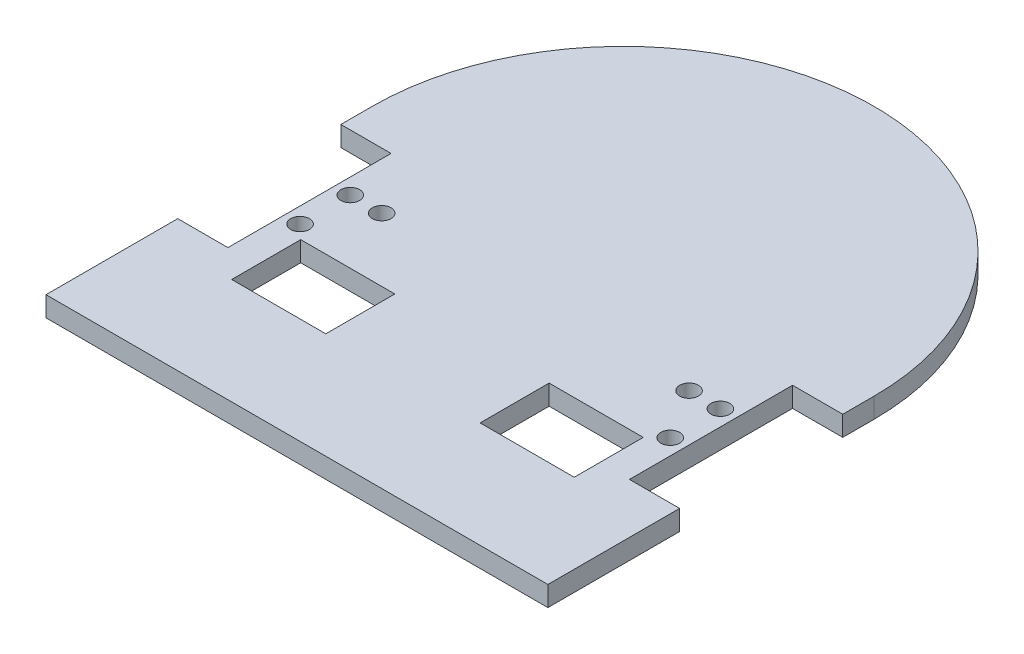
from build123d import *

# Parameters (mm, degrees)
BOSS_EXTRUDE1_DEPTH = 1.6
SKETCH2_W           = 4
SKETCH2_H           = 13
CUT_EXTRUDE2_DEPTH  = 10
SKETCH3_W           = 7.5
SKETCH3_H           = 5.5
CUT_EXTRUDE3_DEPTH  = 10
SKETCH4_R           = 0.75
CUT_EXTRUDE4_DEPTH  = 10


with BuildPart() as part:
    # Sketch1 → Boss-Extrude1 (new body)
    with BuildSketch(Plane(origin=(0, 0, 0), x_dir=(1, 0, 0), z_dir=(0, 1, 0))):
        with BuildLine():
            Line((20, 0), (20, -26))
            Line((20, -26), (-20, -26))
            Line((-20, -26), (-20, 0))
            ThreePointArc((-20, 0), (0, 20), (20, 0))
        make_face()
    extrude(amount=BOSS_EXTRUDE1_DEPTH)

    # Sketch2 → Cut-Extrude2 (cut)
    with BuildSketch(Plane(origin=(0, 3, 0), x_dir=(1, 0, 0), z_dir=(0, 1, 0))):
        with Locations((-18, -9)):
            Rectangle(SKETCH2_W, SKETCH2_H)
        with Locations((18, -9)):
            Rectangle(SKETCH2_W, SKETCH2_H)
    extrude(amount=-CUT_EXTRUDE2_DEPTH, mode=Mode.SUBTRACT)

    # Sketch3 → Cut-Extrude3 (cut)
    with BuildSketch(Plane(origin=(0, 1.6, 0), x_dir=(1, 0, 0), z_dir=(0, 1, 0))):
        with Locations((-9.9, -14.8)):
            Rectangle(SKETCH3_W, SKETCH3_H)
    cut_extrude3 = extrude(amount=-CUT_EXTRUDE3_DEPTH, mode=Mode.SUBTRACT)

    # Mirror1: Cut-Extrude3 across plane
    add(cut_extrude3.mirror(Plane(origin=(0, 0, 0), x_dir=(0, 0, 1), z_dir=(1, 0, 0))), mode=Mode.SUBTRACT)

    # Sketch4 → Cut-Extrude4 (cut)
    with BuildSketch(Plane(origin=(0, 1.6, 0), x_dir=(1, 0, 0), z_dir=(0, 1, 0))):
        with Locations(Location((-14.75, -7, 0), (0, 0, 270))):
            Circle(SKETCH4_R)
        with Locations(Location((-14.75, -11, 0), (0, 0, 270))):
            Circle(SKETCH4_R)
        with Locations(Location((-12.25, -7, 0), (0, 0, 270))):
            Circle(SKETCH4_R)
    cut_extrude4 = extrude(amount=-CUT_EXTRUDE4_DEPTH, mode=Mode.SUBTRACT)

    # Mirror2: Cut-Extrude4 across plane
    add(cut_extrude4.mirror(Plane(origin=(0, 0, 0), x_dir=(0, 0, 1), z_dir=(1, 0, 0))), mode=Mode.SUBTRACT)


solid = part.part
